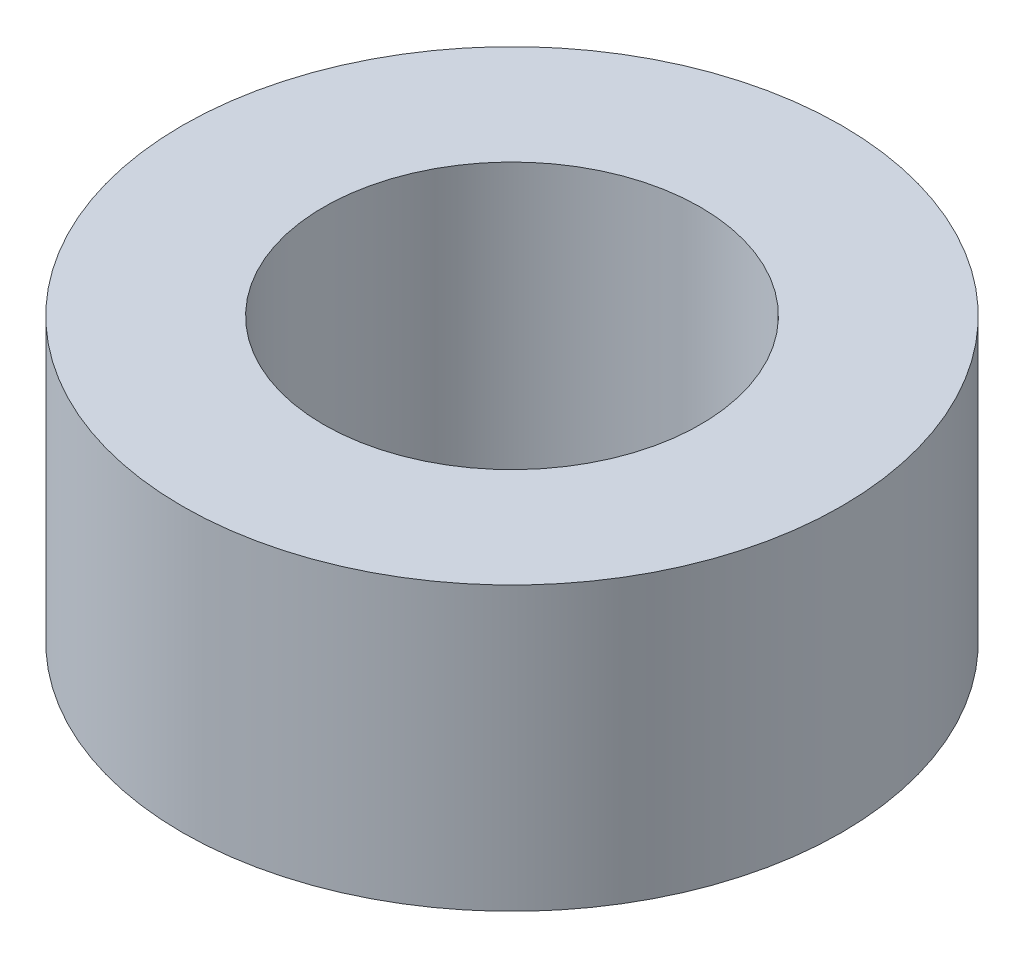
from build123d import *

# Parameters (mm, degrees)
SKETCH1_R           = 3.5
SKETCH1_R_2         = 2
BOSS_EXTRUDE1_DEPTH = 3


with BuildPart() as part:
    # Sketch1 → Boss-Extrude1 (new body)
    with BuildSketch(Plane(origin=(0, 0, 0), x_dir=(1, 0, 0), z_dir=(0, 1, 0))):
        with Locations(Location((0, 0, 0), (0, 0, 270))):
            Circle(SKETCH1_R)
        with Locations(Location((0, 0, 0), (0, 0, 270))):
            Circle(SKETCH1_R_2, mode=Mode.SUBTRACT)
    extrude(amount=BOSS_EXTRUDE1_DEPTH)


solid = part.part
